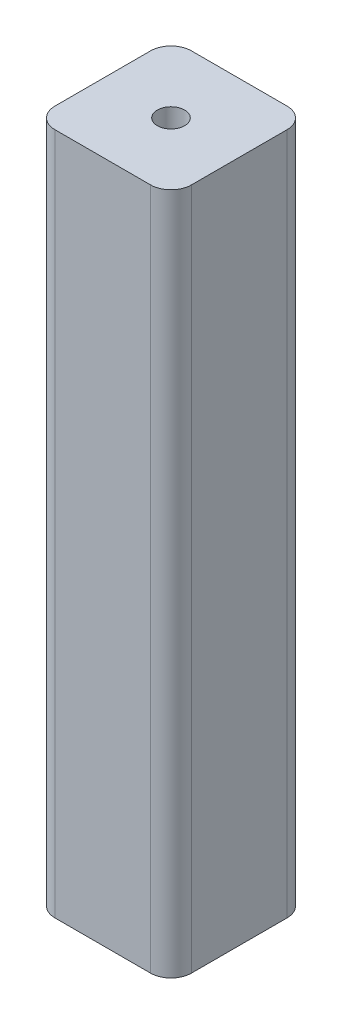
from build123d import *

# Parameters (mm, degrees)
SKETCH1_W           = 20
SKETCH1_H           = 20
BOSS_EXTRUDE1_DEPTH = 100
FILLET1_R           = 3
SKETCH4_R           = 2
CUT_EXTRUDE1_DEPTH  = 10


with BuildPart() as part:
    # Sketch1 → Boss-Extrude1 (new body)
    with BuildSketch(Plane(origin=(0, 0, 0), x_dir=(1, 0, 0), z_dir=(0, 1, 0))):
        Rectangle(SKETCH1_W, SKETCH1_H)
    extrude(amount=BOSS_EXTRUDE1_DEPTH)

    # Fillet1
    fillet1_edges = [part.edges().sort_by_distance(p)[0] for p in [
        (-10, 50, -10),
        (10, 50, -10),
        (10, 50, 10),
        (-10, 50, 10),
    ]]
    fillet(fillet1_edges, radius=FILLET1_R)

    # Sketch4 → Cut-Extrude1 (cut)
    with BuildSketch(Plane(origin=(0, 100, 0), x_dir=(1, 0, 0), z_dir=(0, 1, 0))):
        with Locations(Location((0, 0, 0), (0, 0, 270))):
            Circle(SKETCH4_R)
    cut_extrude1 = extrude(amount=-CUT_EXTRUDE1_DEPTH, mode=Mode.SUBTRACT)

    # Mirror1: Cut-Extrude1 across plane
    add(cut_extrude1.mirror(Plane.ZX.offset(50)), mode=Mode.SUBTRACT)


solid = part.part
